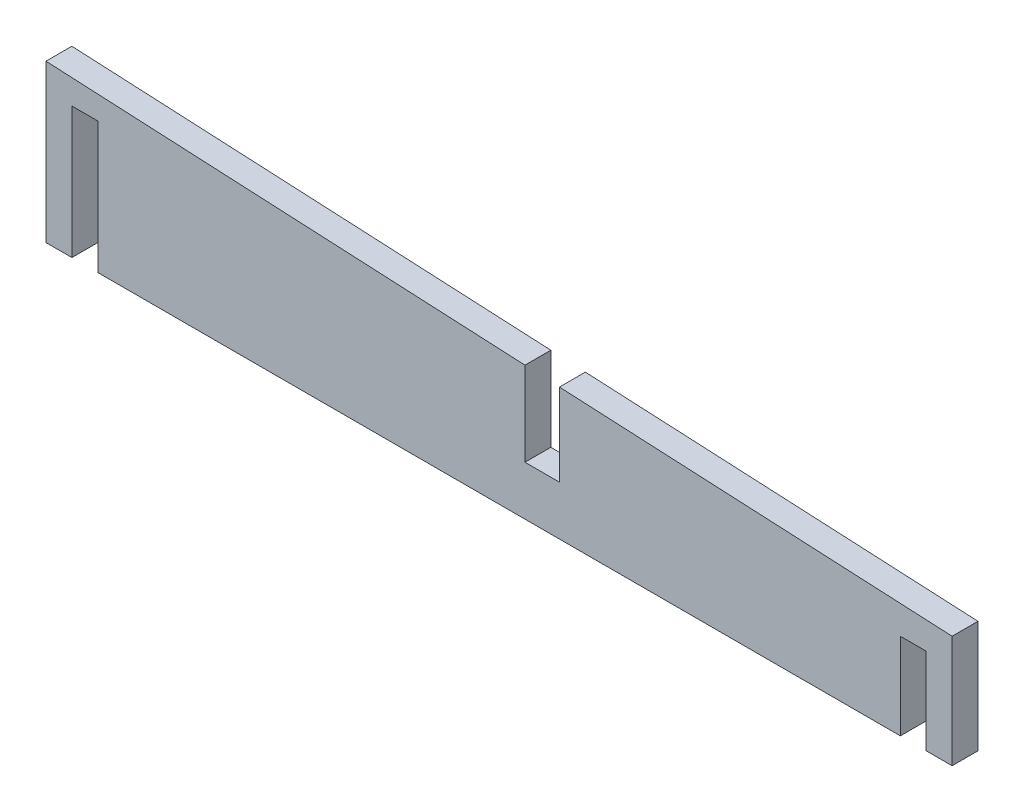
from build123d import *

# Parameters (mm, degrees)
BOSS_EXTRUDE1_DEPTH = 3


with BuildPart() as part:
    # Sketch1 → Boss-Extrude1 (new body)
    with BuildSketch(Plane.XY):
        Polygon((-3, 18), (-3, -0.210083064), (0, -0.210083064), (0, 0), (0, 15), (3, 15), (3, 0), (3, -0.210083064), (96, -0.210083064), (96, 0.789916936), (96, 9.789916936), (99, 9.789916936), (99, 0.789916936), (99, -0.210083064), (102, -0.210083064), (102, 12.789916936), (56.5, 15.047619597), (56.5, 5.5), (52.5, 5.5), (52.5, 15.246098952), align=None)
    extrude(amount=BOSS_EXTRUDE1_DEPTH)


solid = part.part
